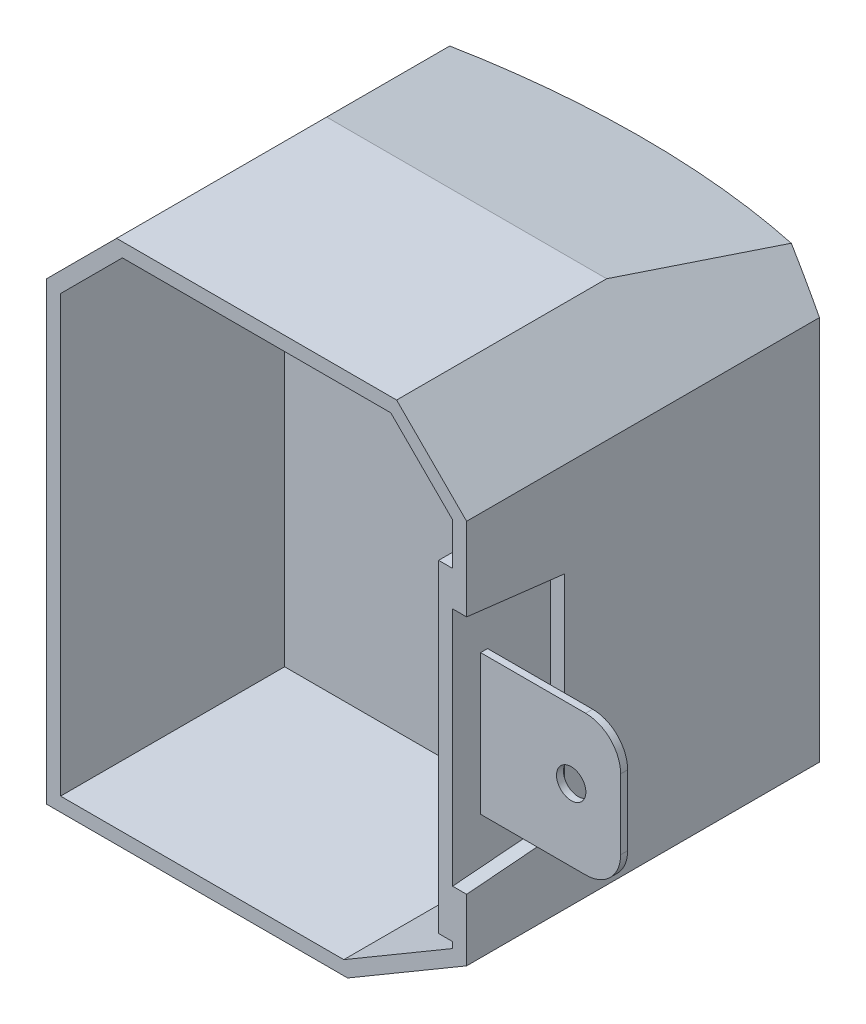
from build123d import *

# Parameters (mm, degrees)
SKETCH_1_W            = 60
SKETCH_1_H            = 75
EXTRUDE_1_DEPTH       = 55
CUT_EXTRUDE_2_DEPTH   = 63
CUT_EXTRUDE_3_DEPTH   = 63
CUT_EXTRUDE_4_DEPTH   = 63
CUT_EXTRUDE_5_DEPTH   = 73
CUT_EXTRUDE_6_DEPTH   = 32
CUT_EXTRUDE_7_DEPTH   = 32
EXTRUDE_2_DEPTH       = 2
SKETCH_10_W           = 1
SKETCH_10_H           = 20
EXTRUDE_3_DEPTH       = 20
FILLET_1_R            = 5
HOLE_WIZARD_M51_D     = 4.2
HOLE_WIZARD_M51_DEPTH = 38.5
HOLE_WIZARD_M51_TIP   = 1.2618073


with BuildPart() as part:
    # Эскиз1 → Бобышка-Вытянуть1 (new body)
    with BuildSketch(Plane.XY):
        with Locations((30, 37.5)):
            Rectangle(SKETCH_1_W, SKETCH_1_H)
    extrude(amount=EXTRUDE_1_DEPTH)

    # Эскиз3 → Вырез-Вытянуть2 (cut)
    with BuildSketch(Plane(origin=(60, 0, 0), x_dir=(0, 0, -1), z_dir=(1, 0, 0))):
        Polygon((0, 0), (0, 10), (-20, 0), align=None)
        Polygon((0, 75), (0, 70), (-25, 75), align=None)
    extrude(amount=-CUT_EXTRUDE_2_DEPTH, mode=Mode.SUBTRACT)

    # Эскиз4 → Вырез-Вытянуть3 (cut)
    with BuildSketch(Plane(origin=(0, 0, 0), x_dir=(-1, 0, 0), z_dir=(0, 0, -1))):
        Polygon((-60, 0), (-60, 10), (-43, 0), align=None)
    extrude(amount=-CUT_EXTRUDE_3_DEPTH, mode=Mode.SUBTRACT)

    # Эскиз5 → Вырез-Вытянуть4 (cut)
    with BuildSketch(Plane(origin=(0, 0, 0), x_dir=(-1, 0, 0), z_dir=(0, 0, -1))):
        Polygon((-60, 75), (-60, 65), (-50, 75), align=None)
        Polygon((-10, 75), (0, 65), (0, 75), align=None)
    extrude(amount=-CUT_EXTRUDE_4_DEPTH, mode=Mode.SUBTRACT)

    # Эскиз6 → Вырез-Вытянуть5 (cut)
    with BuildSketch(Plane(origin=(0, 75, 0), x_dir=(1, 0, 0), z_dir=(0, 1, 0))):
        with BuildLine():
            Line((30.000000357, 0), (0, 0))
            Line((0, 0), (0, -4.606079858))
            ThreePointArc((0, -4.606079858), (14.824230248, -1.158227391), (30.000000357, 0))
        make_face()
        with BuildLine():
            Line((60, 0), (30.000000357, 0))
            ThreePointArc((30.000000357, 0), (45.175770105, -1.158227445), (60, -4.606079858))
            Line((60, -4.606079858), (60, 0))
        make_face()
    extrude(amount=-CUT_EXTRUDE_5_DEPTH, mode=Mode.SUBTRACT)

    # Эскиз7 → Вырез-Вытянуть6 (cut)
    with BuildSketch(Plane.XY.offset(55)):
        Polygon((58, 64.171572875), (49.171572875, 73), (10.828427125, 73), (2, 64.171572875), (2, 2), (42.455383415, 2), (58, 11.143892109), align=None)
    extrude(amount=-CUT_EXTRUDE_6_DEPTH, mode=Mode.SUBTRACT)

    # Эскиз8 → Вырез-Вытянуть7 (cut)
    with BuildSketch(Plane(origin=(60, 0, 0), x_dir=(0, 0, -1), z_dir=(1, 0, 0))):
        Polygon((-55, 18.854810441), (-55, 53.166098562), (-41, 51.5), (-41, 20), align=None)
    extrude(amount=-CUT_EXTRUDE_7_DEPTH, mode=Mode.SUBTRACT)

    # Эскиз9 → Бобышка-Вытянуть2 (add)
    with BuildSketch(Plane.ZY.offset(-58)):
        Polygon((55, 53.166098562), (55, 18.854810441), (55, 12.004066058), (30, 12.004066058), (30, 58.166098562), (55, 58.166098562), align=None)
    extrude(amount=EXTRUDE_2_DEPTH)

    # Эскиз10 → Бобышка-Вытянуть3 (add)
    with BuildSketch(Plane(origin=(58, 0, 0), x_dir=(0, 0, -1), z_dir=(1, 0, 0))):
        with Locations((-50.5, 35.75)):
            Rectangle(SKETCH_10_W, SKETCH_10_H)
    extrude(amount=EXTRUDE_3_DEPTH)

    # Скругление1
    fillet_1_edges = [part.edges().sort_by_distance(p)[0] for p in [
        (78, 45.75, 50.5),
        (78, 25.75, 50.5),
    ]]
    fillet(fillet_1_edges, radius=FILLET_1_R)

    # Отверстие обработанное метчиком M51
    with Locations(Plane(origin=(0, 0, 50), x_dir=(-1, 0, 0), z_dir=(0, 0, -1))):
        with Locations((-70.936057607, 36.012290947)):
            Hole(HOLE_WIZARD_M51_D / 2, depth=HOLE_WIZARD_M51_DEPTH)
            with Locations((0, 0, -(HOLE_WIZARD_M51_DEPTH + HOLE_WIZARD_M51_TIP / 2))):  # 118° drill point
                Cone(0, HOLE_WIZARD_M51_D / 2, HOLE_WIZARD_M51_TIP, mode=Mode.SUBTRACT)


solid = part.part
